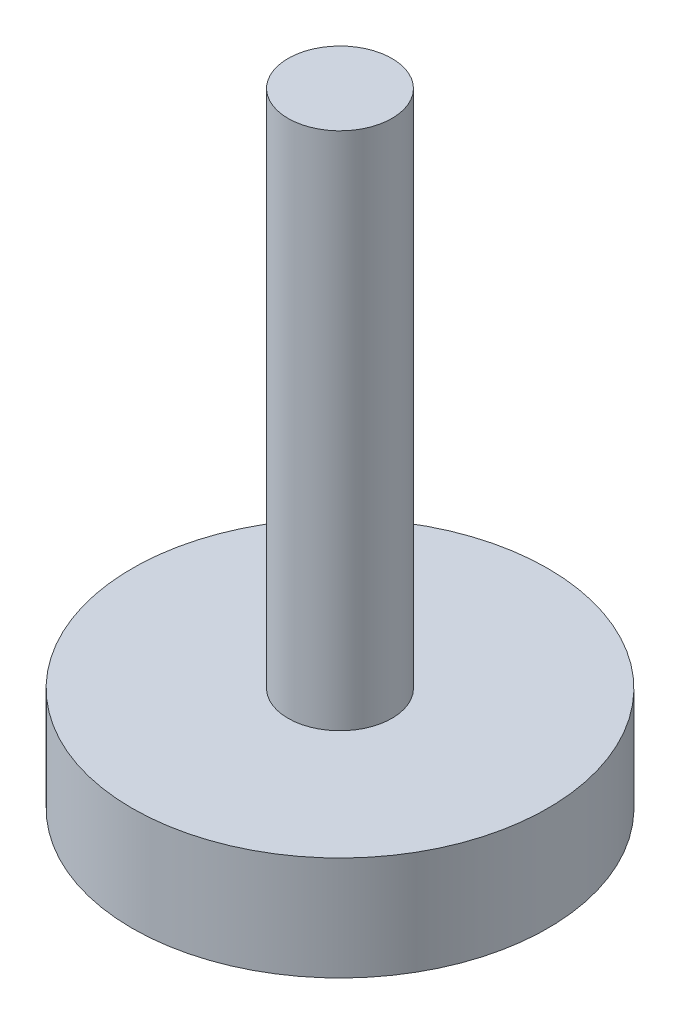
from build123d import *

# Parameters (mm, degrees)
SKIZZE1_R                       = 20
AUFSATZ_LINEAR_AUSTRAGEN1_DEPTH = 10
SKIZZE2_R                       = 5
AUFSATZ_LINEAR_AUSTRAGEN2_DEPTH = 50


with BuildPart() as part:
    # Skizze1 → Aufsatz-Linear austragen1 (new body)
    with BuildSketch(Plane(origin=(0, 0, 0), x_dir=(1, 0, 0), z_dir=(0, 1, 0))):
        with Locations(Location((0, 0, 0), (0, 0, 270))):
            Circle(SKIZZE1_R)
    extrude(amount=AUFSATZ_LINEAR_AUSTRAGEN1_DEPTH)

    # Skizze2 → Aufsatz-Linear austragen2 (add)
    with BuildSketch(Plane(origin=(0, 10, 0), x_dir=(1, 0, 0), z_dir=(0, 1, 0))):
        with Locations(Location((0, 0, 0), (0, 0, 270))):
            Circle(SKIZZE2_R)
    extrude(amount=AUFSATZ_LINEAR_AUSTRAGEN2_DEPTH)


solid = part.part
